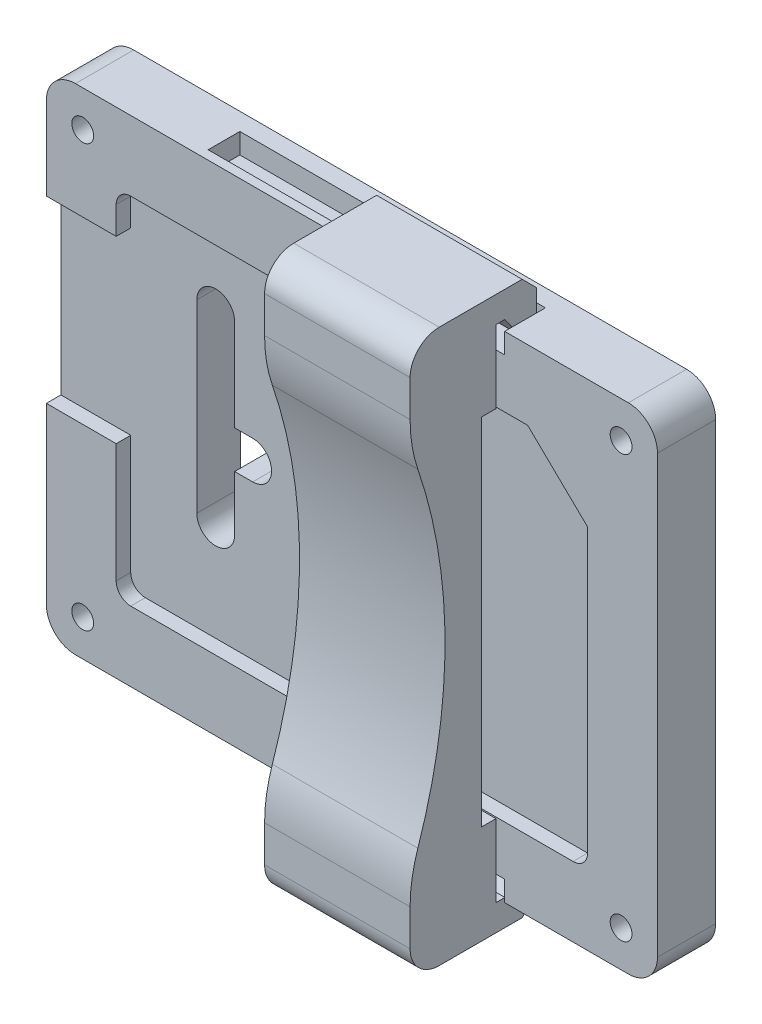
from build123d import *

# Parameters (mm, degrees)
SKIZZE1_W                       = 42
SKIZZE1_H                       = 34
SKIZZE1_R                       = 0.75
AUFSATZ_LINEAR_AUSTRAGEN1_DEPTH = 4
SCHNITT_LINEAR_AUSTRAGEN1_DEPTH = 55.120236511
SCHNITT_LINEAR_AUSTRAGEN2_DEPTH = 55.184868737
SCHNITT_LINEAR_AUSTRAGEN4_DEPTH = 55.184868737
SKIZZE4_W                       = 5.186319123
SKIZZE4_H                       = 12.338044151
SCHNITT_LINEAR_AUSTRAGEN3_DEPTH = 55.120236511
VERRUNDUNG1_R                   = 2
VERRUNDUNG2_R                   = 1
FASE2_SIZE                      = 0.5
SCHNITT_LINEAR_AUSTRAGEN8_DEPTH = 10.5
SKIZZE15_W                      = 4.03797119
SKIZZE15_H                      = 1.639176424
SCHNITT_LINEAR_AUSTRAGEN9_DEPTH = 10.5
AUFSATZ_LINEAR_AUSTRAGEN5_DEPTH = 10
FASE4_SIZE                      = 1
VERRUNDUNG10_R                  = 2
VERRUNDUNG11_R                  = 10


with BuildPart() as part:
    # Skizze1 → Aufsatz-Linear austragen1 (new body)
    with BuildSketch(Plane.XY):
        with Locations((-21, 17)):
            Rectangle(SKIZZE1_W, SKIZZE1_H)
        with Locations((-39.5, 31.5)):
            Circle(SKIZZE1_R, mode=Mode.SUBTRACT)
        with Locations((-2.5, 31.5)):
            Circle(SKIZZE1_R, mode=Mode.SUBTRACT)
        with Locations((-39.5, 2.5)):
            Circle(SKIZZE1_R, mode=Mode.SUBTRACT)
        with Locations((-2.5, 2.5)):
            Circle(SKIZZE1_R, mode=Mode.SUBTRACT)
    extrude(amount=AUFSATZ_LINEAR_AUSTRAGEN1_DEPTH)

    # Skizze2 → Schnitt-Linear austragen1 (cut, through all)
    with BuildSketch(Plane.XY.offset(3)):
        Polygon((-37.2, 29.2), (-37.2, 4.8), (-4.8, 4.8), (-4.8, 25.209708368), (-8.919010717, 29.2), align=None)
    extrude(amount=SCHNITT_LINEAR_AUSTRAGEN1_DEPTH, mode=Mode.SUBTRACT)

    # Skizze3 → Schnitt-Linear austragen2 (cut, through all)
    with BuildSketch(Plane.XY):
        with BuildLine():
            Line((-30.06, 24.3), (-30.06, 11.6))
            ThreePointArc((-30.06, 11.6), (-31.36, 10.3), (-32.66, 11.6))
            Line((-32.66, 11.6), (-32.66, 24.3))
            ThreePointArc((-32.66, 24.3), (-31.36, 25.6), (-30.06, 24.3))
        make_face()
        with BuildLine():
            Line((-19.9, 24.3), (-19.9, 21.76))
            ThreePointArc((-19.9, 21.76), (-21.2, 20.46), (-22.5, 21.76))
            Line((-22.5, 21.76), (-22.5, 24.3))
            ThreePointArc((-22.5, 24.3), (-21.2, 25.6), (-19.9, 24.3))
        make_face()
    extrude(amount=SCHNITT_LINEAR_AUSTRAGEN2_DEPTH, mode=Mode.SUBTRACT)

    # Skizze5 → Schnitt-Linear austragen4 (cut, through all)
    with BuildSketch(Plane.XY):
        with BuildLine():
            Line((-28.82, 15.38), (-31.36, 15.38))
            ThreePointArc((-31.36, 15.38), (-32.66, 16.68), (-31.36, 17.98))
            Line((-31.36, 17.98), (-28.82, 17.98))
            ThreePointArc((-28.82, 17.98), (-27.52, 16.68), (-28.82, 15.38))
        make_face()
        with BuildLine():
            Line((-18.66, 20.46), (-21.2, 20.46))
            ThreePointArc((-21.2, 20.46), (-22.5, 21.76), (-21.2, 23.06))
            Line((-21.2, 23.06), (-18.66, 23.06))
            ThreePointArc((-18.66, 23.06), (-17.36, 21.76), (-18.66, 20.46))
        make_face()
    extrude(amount=SCHNITT_LINEAR_AUSTRAGEN4_DEPTH, mode=Mode.SUBTRACT)

    # Skizze4 → Schnitt-Linear austragen3 (cut, through all)
    with BuildSketch(Plane.XY.offset(3)):
        with Locations((-39.793159562, 20.13653497)):
            Rectangle(SKIZZE4_W, SKIZZE4_H)
    extrude(amount=SCHNITT_LINEAR_AUSTRAGEN3_DEPTH, mode=Mode.SUBTRACT)

    # Verrundung1
    verrundung1_edges = [part.edges().sort_by_distance(p)[0] for p in [
        (0, 0, 2),
        (-42, 0, 2),
        (-42, 34, 2),
        (0, 34, 2),
    ]]
    fillet(verrundung1_edges, radius=VERRUNDUNG1_R)

    # Verrundung2
    verrundung2_edges = [part.edges().sort_by_distance(p)[0] for p in [
        (-37.2, 29.2, 3.5),
        (-37.2, 4.8, 3.5),
        (-4.8, 4.8, 3.5),
    ]]
    fillet(verrundung2_edges, radius=VERRUNDUNG2_R)

    # Fase2
    fase2_edges = [part.edges().sort_by_distance(p)[0] for p in [
        (-40.25, 31.5, 0),
        (-3.25, 31.5, 0),
        (-40.25, 2.5, 0),
        (-3.25, 2.5, 0),
    ]]
    chamfer(fase2_edges, length=FASE2_SIZE)

    # Skizze14 → Schnitt-Linear austragen8 (cut, symmetric)
    with BuildSketch(Plane(origin=(-21, 0, 0), x_dir=(0, 0, -1), z_dir=(1, 0, 0))):
        Polygon((-3.380290553, 34), (-1.2, 34), (-1.2, 32.6), (-2.4, 32.6), align=None)
    schnitt_linear_austragen8 = extrude(amount=SCHNITT_LINEAR_AUSTRAGEN8_DEPTH, both=True, mode=Mode.SUBTRACT)

    # Skizze15 → Schnitt-Linear austragen9 (cut)
    with BuildSketch(Plane(origin=(-21, 0, 0), x_dir=(0, 0, -1), z_dir=(1, 0, 0))):
        with Locations((-3.218985595, 33.419588212)):
            Rectangle(SKIZZE15_W, SKIZZE15_H)
    schnitt_linear_austragen9 = extrude(amount=SCHNITT_LINEAR_AUSTRAGEN9_DEPTH, mode=Mode.SUBTRACT)

    # Spiegeln2: Schnitt-Linear austragen8, Schnitt-Linear austragen9 across plane
    add(schnitt_linear_austragen8.mirror(Plane.ZX.offset(17)), mode=Mode.SUBTRACT)
    add(schnitt_linear_austragen9.mirror(Plane.ZX.offset(17)), mode=Mode.SUBTRACT)


with BuildPart() as body_2:
    # Skizze16 → Aufsatz-Linear austragen5 (new body)
    with BuildSketch(Plane(origin=(-21, 0, 0), x_dir=(0, 0, -1), z_dir=(1, 0, 0))):
        with BuildLine():
            Line((-4.1, 34.2), (-3.480290553, 34.2))
            Line((-3.480290553, 34.2), (-2.5, 32.8))
            Line((-2.5, 32.8), (-1.3, 32.8))
            Line((-1.3, 32.8), (-1.3, 36))
            Line((-1.3, 36), (-10, 36))
            Line((-10, 36), (-10, 29.737346662))
            ThreePointArc((-10, 29.737346662), (-8.205232956, 23.480740698), (-7.6, 17))
            Line((-7.6, 17), (-5.1, 17))
            Line((-5.1, 17), (-5.1, 29.2))
            Line((-5.1, 29.2), (-4.1, 29.2))
            Line((-4.1, 29.2), (-4.1, 34.2))
        make_face()
    extrude(amount=AUFSATZ_LINEAR_AUSTRAGEN5_DEPTH)

    # Fase4
    fase4_edges = [body_2.edges().sort_by_distance(p)[0] for p in [
        (-16, 36, 1.3),
    ]]
    chamfer(fase4_edges, length=FASE4_SIZE)

    # Verrundung10
    verrundung10_edges = [body_2.edges().sort_by_distance(p)[0] for p in [
        (-16, 36, 10),
    ]]
    fillet(verrundung10_edges, radius=VERRUNDUNG10_R)

    # Verrundung11
    verrundung11_edges = [body_2.edges().sort_by_distance(p)[0] for p in [
        (-16, 29.737346662, 10),
    ]]
    fillet(verrundung11_edges, radius=VERRUNDUNG11_R)

    # Spiegeln3: body 2 across plane


with BuildPart() as body_2_1:
    add(body_2.part)
    add(body_2.part.mirror(Plane.ZX.offset(17)))


solid = Compound([part.part, body_2_1.part])
